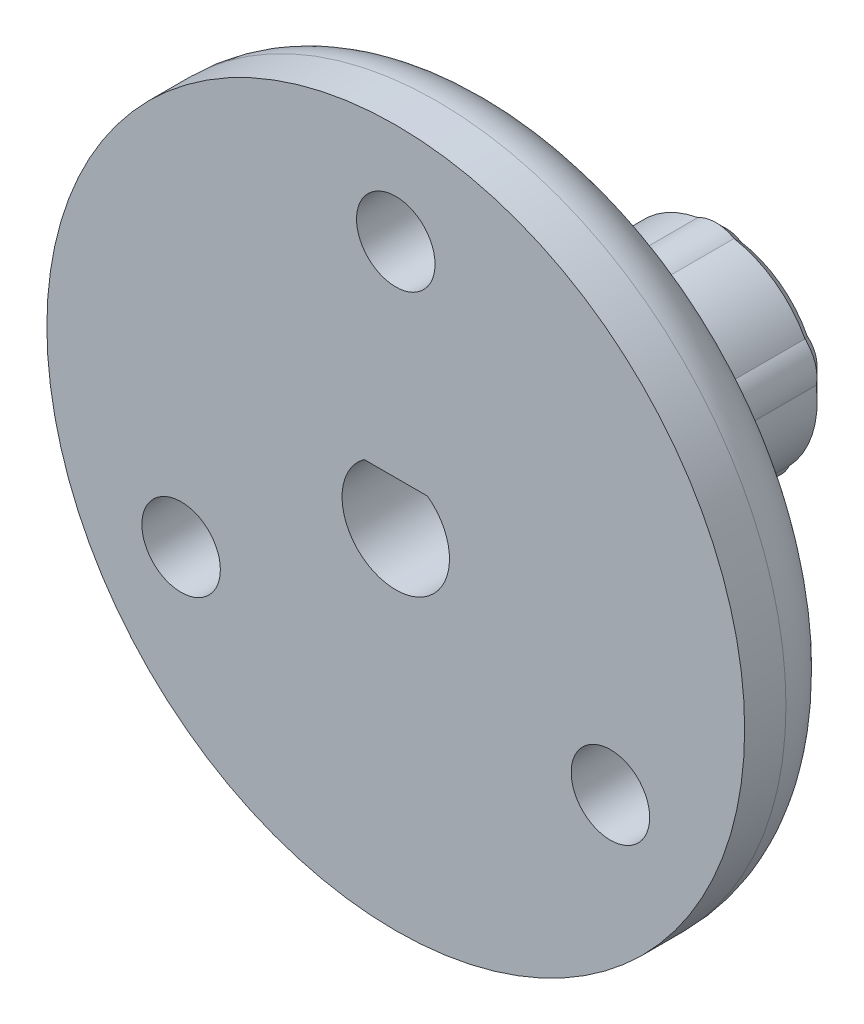
from build123d import *

# Parameters (mm, degrees)
AUFSATZ_LINEAR_AUSTRAGEN1_DEPTH = 16
SCHNITT_LINEAR_AUSTRAGEN1_DEPTH = 16
VERRUNDUNG3_R                   = 3
SKIZZE6_R                       = 1.9
SCHNITT_LINEAR_AUSTRAGEN2_DEPTH = 4.5
KREISMUSTER1_COUNT              = 3
FASE1_SIZE                      = 0.5


with BuildPart() as part:
    # Skizze3 → Aufsatz-Linear austragen1 (new body)
    with BuildSketch(Plane.XY):
        with BuildLine():
            ThreePointArc((3.545052466, -3.382691682), (4.66017693, -1.514183272), (4.856303974, 0.652925499))
            ThreePointArc((4.856303974, 0.652925499), (4.802835407, 1.560535822), (4.312612425, 2.326236032))
            ThreePointArc((4.312612425, 2.326236032), (2.880147736, 3.964183272), (0.879711407, 4.820384615))
            ThreePointArc((0.879711407, 4.820384615), (0, 5.05), (-0.879711407, 4.820384615))
            ThreePointArc((-0.879711407, 4.820384615), (-2.880147736, 3.964183272), (-4.312612425, 2.326236032))
            ThreePointArc((-4.312612425, 2.326236032), (-4.802835407, 1.560535822), (-4.856303974, 0.652925499))
            ThreePointArc((-4.856303974, 0.652925499), (-4.66017693, -1.514183272), (-3.545052466, -3.382691682))
            ThreePointArc((-3.545052466, -3.382691682), (-2.968315524, -4.085535822), (-2.121649509, -4.416854465))
            ThreePointArc((-2.121649509, -4.416854465), (0, -4.9), (2.121649509, -4.416854465))
            ThreePointArc((2.121649509, -4.416854465), (2.968315524, -4.085535822), (3.545052466, -3.382691682))
        make_face()
    extrude(amount=AUFSATZ_LINEAR_AUSTRAGEN1_DEPTH)

    # Skizze4 → Schnitt-Linear austragen1 (cut)
    with BuildSketch(Plane(origin=(0, 0, 0), x_dir=(-1, 0, 0), z_dir=(0, 0, -1))):
        with BuildLine():
            Line((-1.532970972, 2.1), (1.532970972, 2.1))
            ThreePointArc((1.532970972, 2.1), (0, -2.6), (-1.532970972, 2.1))
        make_face()
    extrude(amount=-SCHNITT_LINEAR_AUSTRAGEN1_DEPTH, mode=Mode.SUBTRACT)

    # Skizze5 → Rotation1 (revolve)
    with BuildSketch(Plane(origin=(0, 0, 0), x_dir=(1, 0, 0), z_dir=(0, 1, 0)), mode=Mode.PRIVATE) as rotation1_sk:
        Polygon((-4.890933678, -16), (-16.890933678, -16), (-16.890933678, -11), (-6.890933678, -11), (-6.890933678, -8), (-4.890933678, -8), align=None)
    revolve(rotation1_sk.sketch.rotate(Axis((0, 0, 16), (0, 0, -1)), 180), axis=Axis((0, 0, 16), (0, 0, -1)))

    # Verrundung3
    verrundung3_edges = [part.edges().sort_by_distance(p)[0] for p in [
        (-16.890933678, 0, 11),
    ]]
    fillet(verrundung3_edges, radius=VERRUNDUNG3_R)

    # Skizze6 → Schnitt-Linear austragen2 (cut)
    with BuildSketch(Plane.XY.offset(16)):
        with Locations((0, 12)):
            Circle(SKIZZE6_R)
    schnitt_linear_austragen2 = extrude(amount=-SCHNITT_LINEAR_AUSTRAGEN2_DEPTH, mode=Mode.SUBTRACT)

    # Kreismuster1: Schnitt-Linear austragen2 ×3 about axis
    kreismuster1_axis = Axis((0, 0, 0), (0, 0, 1))
    for i in range(1, KREISMUSTER1_COUNT):
        add(schnitt_linear_austragen2.rotate(kreismuster1_axis, i * 360 / KREISMUSTER1_COUNT), mode=Mode.SUBTRACT)

    # Fase1
    fase1_edges = [part.edges().sort_by_distance(p)[0] for p in [
        (0, 5.05, 0),
        (2.880147736, 3.964183272, 0),
        (4.802835407, 1.560535822, 0),
        (4.66017693, -1.514183272, 0),
        (2.968315524, -4.085535822, 0),
        (0, -4.9, 0),
        (-2.968315524, -4.085535822, 0),
        (-4.66017693, -1.514183272, 0),
        (-4.802835407, 1.560535822, 0),
        (-2.880147736, 3.964183272, 0),
    ]]
    chamfer(fase1_edges, length=FASE1_SIZE)


solid = part.part
